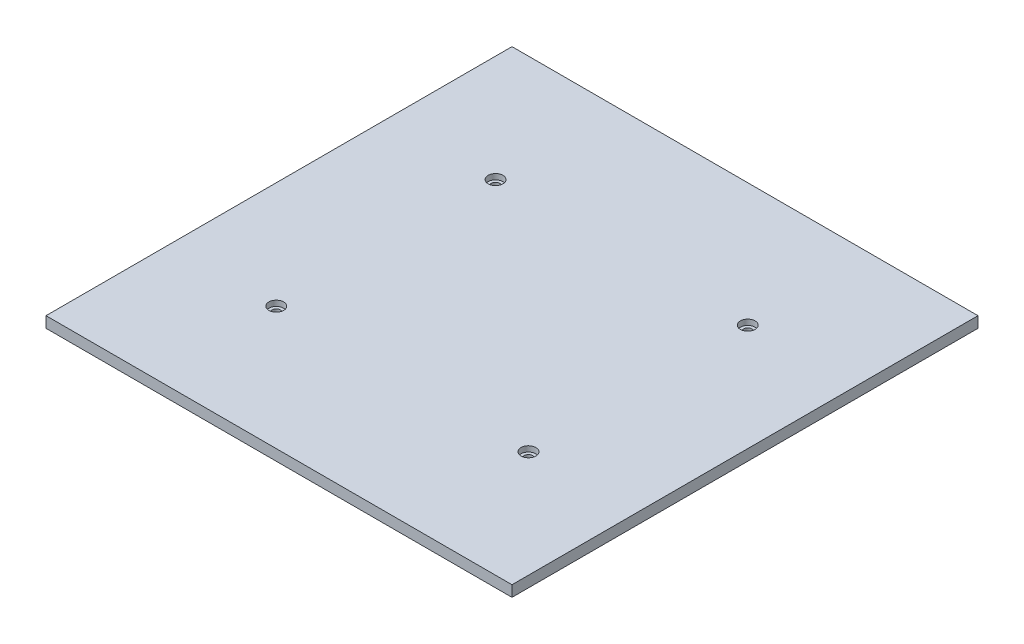
from build123d import *

# Parameters (mm, degrees)
SKETCH1_W           = 170
SKETCH1_H           = 170
BOSS_EXTRUDE1_DEPTH = 4
CUT_EXTRUDE1_REACH  = 122.275
SKETCH2_R           = 1.6
SKETCH2_3_R         = 2.7
SKETCH2_3_R_2       = 1.6
CUT_EXTRUDE2_DEPTH  = 2


with BuildPart() as part:
    # Sketch1 → Boss-Extrude1 (new body)
    with BuildSketch(Plane(origin=(0, 0, 0), x_dir=(1, 0, 0), z_dir=(0, 1, 0))):
        Rectangle(SKETCH1_W, SKETCH1_H)
    extrude(amount=BOSS_EXTRUDE1_DEPTH)

    # Sketch2 → Cut-Extrude1 (cut, up to next)
    with BuildSketch(Plane(origin=(0, 4, 0), x_dir=(1, 0, 0), z_dir=(0, 1, 0)), mode=Mode.PRIVATE) as cut_extrude1_sk1:
        with Locations((46, 40)):
            Circle(SKETCH2_R)
    cut_extrude1_tool1 = extrude(cut_extrude1_sk1.sketch, amount=-CUT_EXTRUDE1_REACH, mode=Mode.PRIVATE) & part.part
    # Sketch2 → Cut-Extrude1 (cut, up to next)
    with BuildSketch(Plane(origin=(0, 4, 0), x_dir=(1, 0, 0), z_dir=(0, 1, 0)), mode=Mode.PRIVATE) as cut_extrude1_sk2:
        with Locations((-46, 40)):
            Circle(SKETCH2_R)
    cut_extrude1_tool2 = extrude(cut_extrude1_sk2.sketch, amount=-CUT_EXTRUDE1_REACH, mode=Mode.PRIVATE) & part.part
    # Sketch2 → Cut-Extrude1 (cut, up to next)
    with BuildSketch(Plane(origin=(0, 4, 0), x_dir=(1, 0, 0), z_dir=(0, 1, 0)), mode=Mode.PRIVATE) as cut_extrude1_sk3:
        with Locations((46, -40)):
            Circle(SKETCH2_R)
    cut_extrude1_tool3 = extrude(cut_extrude1_sk3.sketch, amount=-CUT_EXTRUDE1_REACH, mode=Mode.PRIVATE) & part.part
    # Sketch2 → Cut-Extrude1 (cut, up to next)
    with BuildSketch(Plane(origin=(0, 4, 0), x_dir=(1, 0, 0), z_dir=(0, 1, 0)), mode=Mode.PRIVATE) as cut_extrude1_sk4:
        with Locations((-46, -40)):
            Circle(SKETCH2_R)
    cut_extrude1_tool4 = extrude(cut_extrude1_sk4.sketch, amount=-CUT_EXTRUDE1_REACH, mode=Mode.PRIVATE) & part.part
    add(cut_extrude1_tool1.solids().sort_by_distance((46, 4, -40))[0], mode=Mode.SUBTRACT)
    add(cut_extrude1_tool2.solids().sort_by_distance((-46, 4, -40))[0], mode=Mode.SUBTRACT)
    add(cut_extrude1_tool3.solids().sort_by_distance((46, 4, 40))[0], mode=Mode.SUBTRACT)
    add(cut_extrude1_tool4.solids().sort_by_distance((-46, 4, 40))[0], mode=Mode.SUBTRACT)

    # Sketch2<3> → Cut-Extrude2 (cut)
    # profile 1 of 4: a face of its own
    with BuildSketch(Plane(origin=(0, 4, 0), x_dir=(1, 0, 0), z_dir=(0, 1, 0))):
        with Locations((46, 40)):
            Circle(SKETCH2_3_R)
        with Locations((46, 40)):
            Circle(SKETCH2_3_R_2, mode=Mode.SUBTRACT)
    # profile 2 of 4: a face of its own
    with BuildSketch(Plane(origin=(0, 4, 0), x_dir=(1, 0, 0), z_dir=(0, 1, 0))):
        with Locations((-46, 40)):
            Circle(SKETCH2_3_R)
        with Locations((-46, 40)):
            Circle(SKETCH2_3_R_2, mode=Mode.SUBTRACT)
    # profile 3 of 4: a face of its own
    with BuildSketch(Plane(origin=(0, 4, 0), x_dir=(1, 0, 0), z_dir=(0, 1, 0))):
        with Locations((46, -40)):
            Circle(SKETCH2_3_R)
        with Locations((46, -40)):
            Circle(SKETCH2_3_R_2, mode=Mode.SUBTRACT)
    # profile 4 of 4: a face of its own
    with BuildSketch(Plane(origin=(0, 4, 0), x_dir=(1, 0, 0), z_dir=(0, 1, 0))):
        with Locations((-46, -40)):
            Circle(SKETCH2_3_R)
        with Locations((-46, -40)):
            Circle(SKETCH2_3_R_2, mode=Mode.SUBTRACT)
    extrude(amount=-CUT_EXTRUDE2_DEPTH, mode=Mode.SUBTRACT)


solid = part.part
